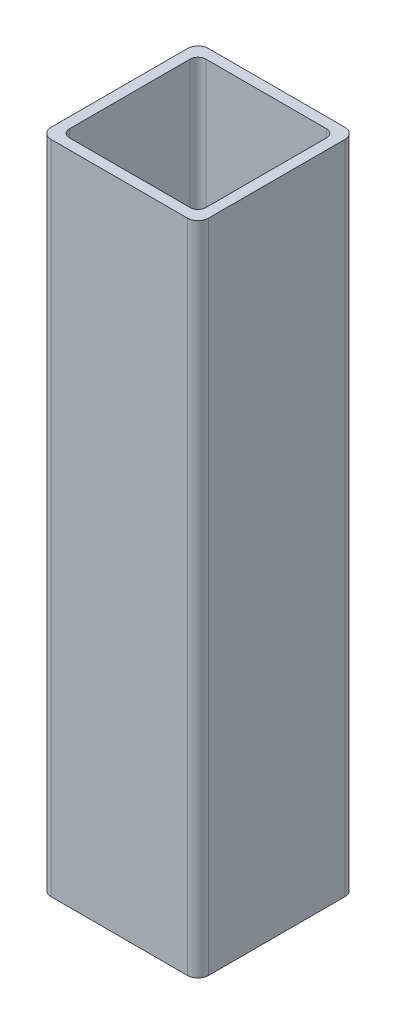
from build123d import *

# Parameters (mm, degrees)
EXTRUDE_1_DEPTH      = 100
EXTRUDE_1_DEPTH_BACK = 150


with BuildPart() as part:
    # Эскиз1 → Бобышка-Вытянуть1 (new, two sides: drawn at the far end of the back side and taken through both)
    with BuildSketch(Plane(origin=(0, 0, 0), x_dir=(1, 0, 0), z_dir=(0, 1, 0)).offset(-EXTRUDE_1_DEPTH_BACK)):
        with BuildLine():
            Line((-56, 0), (-4, 0))
            ThreePointArc((-4, 0), (-1.171572875, -1.171572875), (0, -4))
            Line((0, -4), (0, -56))
            ThreePointArc((0, -56), (-1.171572875, -58.828427125), (-4, -60))
            Line((-4, -60), (-56, -60))
            ThreePointArc((-56, -60), (-58.828427125, -58.828427125), (-60, -56))
            Line((-60, -56), (-60, -4))
            ThreePointArc((-60, -4), (-58.828427125, -1.171572875), (-56, 0))
        make_face()
        with BuildLine():
            Line((-53, -4), (-7, -4))
            ThreePointArc((-7, -4), (-4.878679656, -4.878679656), (-4, -7))
            Line((-4, -7), (-4, -53))
            ThreePointArc((-4, -53), (-4.878679656, -55.121320344), (-7, -56))
            Line((-7, -56), (-53, -56))
            ThreePointArc((-53, -56), (-55.121320344, -55.121320344), (-56, -53))
            Line((-56, -53), (-56, -7))
            ThreePointArc((-56, -7), (-55.121320344, -4.878679656), (-53, -4))
        make_face(mode=Mode.SUBTRACT)
    extrude(amount=EXTRUDE_1_DEPTH + EXTRUDE_1_DEPTH_BACK)


solid = part.part
